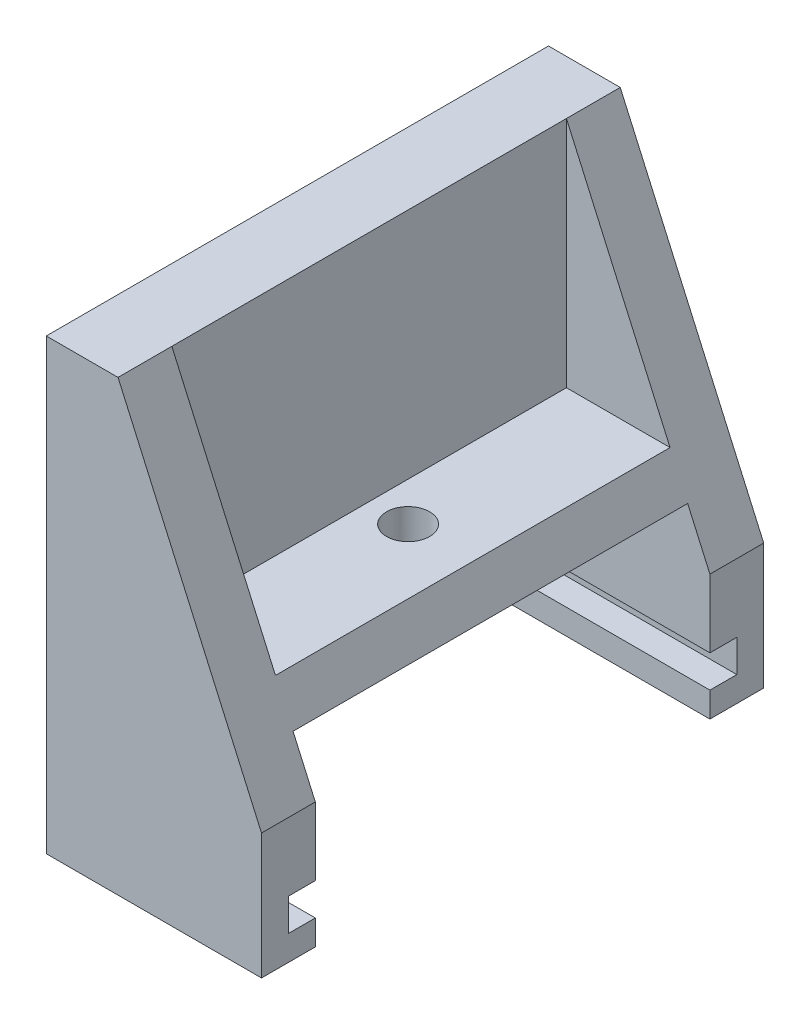
from build123d import *

# Parameters (mm, degrees)
BOSS_EXTRUDE1_DEPTH = 28
SKETCH4_W           = 22
SKETCH4_H           = 10
CUT_EXTRUDE2_DEPTH  = 15
SKETCH5_W           = 1.5
SKETCH5_H           = 1.8
CUT_EXTRUDE3_DEPTH  = 15
CUT_EXTRUDE4_DEPTH  = 11
SKETCH7_R           = 1.2
CUT_EXTRUDE5_DEPTH  = 4


with BuildPart() as part:
    # Sketch1 → Boss-Extrude1 (new body)
    with BuildSketch(Plane.XY):
        Polygon((0, 0), (0, -25), (12, -25), (12, -18), (4, 0), align=None)
    extrude(amount=-BOSS_EXTRUDE1_DEPTH)

    # Sketch4 → Cut-Extrude2 (cut)
    with BuildSketch(Plane.ZY):
        with Locations((-14, -20.207997185)):
            Rectangle(SKETCH4_W, SKETCH4_H)
    extrude(amount=-CUT_EXTRUDE2_DEPTH, mode=Mode.SUBTRACT)

    # Sketch5 → Cut-Extrude3 (cut)
    with BuildSketch(Plane.ZY):
        with Locations((-2.25, -22.7)):
            Rectangle(SKETCH5_W, SKETCH5_H)
    cut_extrude3 = extrude(amount=-CUT_EXTRUDE3_DEPTH, mode=Mode.SUBTRACT)

    # Mirror1: Cut-Extrude3 across plane
    add(cut_extrude3.mirror(Plane.XY.offset(-14)), mode=Mode.SUBTRACT)

    # Sketch6 → Cut-Extrude4 (cut, symmetric)
    with BuildSketch(Plane.XY.offset(-14)):
        Polygon((4, 0), (4, -13), (9.777777778, -13), align=None)
    extrude(amount=CUT_EXTRUDE4_DEPTH, both=True, mode=Mode.SUBTRACT)

    # Sketch7 → Cut-Extrude5 (cut)
    with BuildSketch(Plane(origin=(0, -13, 0), x_dir=(1, 0, 0), z_dir=(0, 1, 0))):
        with Locations(Location((6.172753197, 14, 0), (0, 0, 270))):
            Circle(SKETCH7_R)
    extrude(amount=-CUT_EXTRUDE5_DEPTH, mode=Mode.SUBTRACT)


solid = part.part
